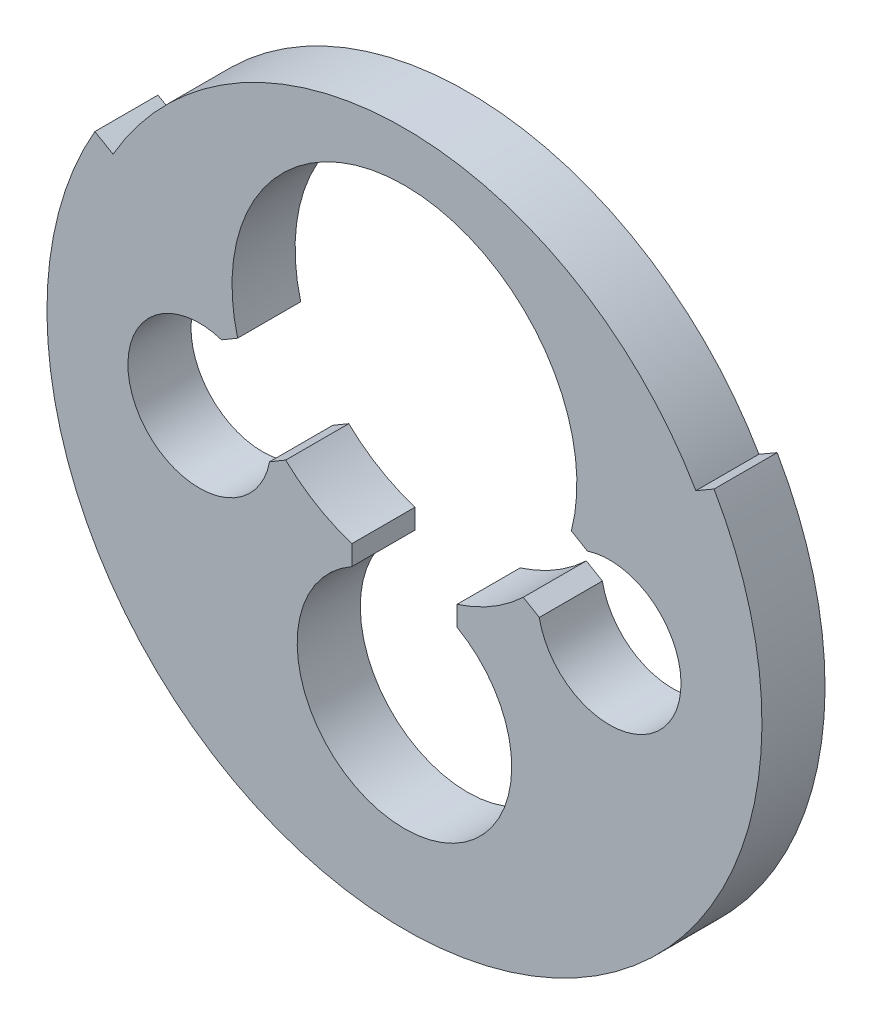
from build123d import *

# Parameters (mm, degrees)
EXTRUDE_1_DEPTH                 = 1.5
BOSS_EXTRUDE3_REACH             = 24.677
BOSS_EXTRUDE3_DIRECTION_2_REACH = 24.677


with BuildPart() as part:
    # Эскиз1 → Бобышка-Вытянуть1 (new, symmetric)
    with BuildSketch(Plane.XY):
        with BuildLine():
            ThreePointArc((5, -15.198684154), (15.454813221, -4.141104722), (11.929469096, 10.662446581))
            ThreePointArc((11.929469096, 10.662446581), (-15.454813221, 4.141104722), (5, -15.198684154))
        make_face()
        with BuildLine():
            Line((-2.5, -2.359609465), (-2.5, -3.304777846))
            ThreePointArc((-2.5, -3.304777846), (0, -12.85), (2.5, -3.304777846))
            Line((2.5, -3.304777846), (2.5, -2.359609465))
            ThreePointArc((2.5, -2.359609465), (4.180016715, -1.604605606), (5.649137352, -0.493672869))
            Line((5.649137352, -0.493672869), (6.41139529, -0.943209602))
            ThreePointArc((6.41139529, -0.943209602), (12.678644072, -2.027149068), (8.69732788, 2.932936963))
            Line((8.69732788, 2.932936963), (7.935069942, 3.382473696))
            ThreePointArc((7.935069942, 3.382473696), (0, 13.65), (-7.935069942, 3.382473696))
            Line((-7.935069942, 3.382473696), (-8.69732788, 2.932936963))
            ThreePointArc((-8.69732788, 2.932936963), (-12.678644072, -2.027149068), (-6.41139529, -0.943209602))
            Line((-6.41139529, -0.943209602), (-5.649137352, -0.493672869))
            ThreePointArc((-5.649137352, -0.493672869), (-4.180016715, -1.604605606), (-2.5, -2.359609465))
        make_face(mode=Mode.SUBTRACT)
    extrude(amount=EXTRUDE_1_DEPTH, both=True)

    # Boss-Extrude3: up to this face of the body (flat: up to its plane)
    boss_extrude3_end = Plane(part.part.faces().sort_by_distance((15.017685091, -4.023976592, 1.5))[0])
    # Sketch2 → Boss-Extrude3 (add, up to the picked face)
    with BuildSketch(Plane.XY, mode=Mode.PRIVATE) as boss_extrude3_sk1:
        with BuildLine():
            ThreePointArc((13.856406461, 8), (0, -16), (-13.856406461, 8))
            Line((-13.856406461, 8), (-14.722431864, 8.5))
            ThreePointArc((-14.722431864, 8.5), (-15.822781238, -6.216075442), (-5, -16.248076809))
            ThreePointArc((-5, -16.248076809), (13.294669863, -10.59489279), (14.722431864, 8.5))
            Line((14.722431864, 8.5), (13.856406461, 8))
        make_face()
    boss_extrude3_tool1 = split(extrude(boss_extrude3_sk1.sketch, amount=BOSS_EXTRUDE3_REACH, mode=Mode.PRIVATE), bisect_by=boss_extrude3_end, keep=Keep.BOTH, mode=Mode.PRIVATE)
    add(boss_extrude3_tool1.solids().sort_by(Axis((14.501919, 7.881939, 0), (0, 0, 1)))[0])

    # Boss-Extrude3 direction 2: up to this face of the body (flat: up to its plane)
    boss_extrude3_direction_2_end = Plane(part.part.faces().sort_by_distance((15.017685091, -4.023976592, -1.5))[0])
    # Sketch2 → Boss-Extrude3 direction 2 (add, up to the picked face)
    with BuildSketch(Plane.XY, mode=Mode.PRIVATE) as boss_extrude3_direction_2_sk1:
        with BuildLine():
            ThreePointArc((13.856406461, 8), (0, -16), (-13.856406461, 8))
            Line((-13.856406461, 8), (-14.722431864, 8.5))
            ThreePointArc((-14.722431864, 8.5), (-15.822781238, -6.216075442), (-5, -16.248076809))
            ThreePointArc((-5, -16.248076809), (13.294669863, -10.59489279), (14.722431864, 8.5))
            Line((14.722431864, 8.5), (13.856406461, 8))
        make_face()
    boss_extrude3_direction_2_tool1 = split(extrude(boss_extrude3_direction_2_sk1.sketch, amount=-BOSS_EXTRUDE3_DIRECTION_2_REACH, mode=Mode.PRIVATE), bisect_by=boss_extrude3_direction_2_end, keep=Keep.BOTH, mode=Mode.PRIVATE)
    add(boss_extrude3_direction_2_tool1.solids().sort_by(Axis((14.501919, 7.881939, 0), (0, 0, -1)))[0])


solid = part.part
